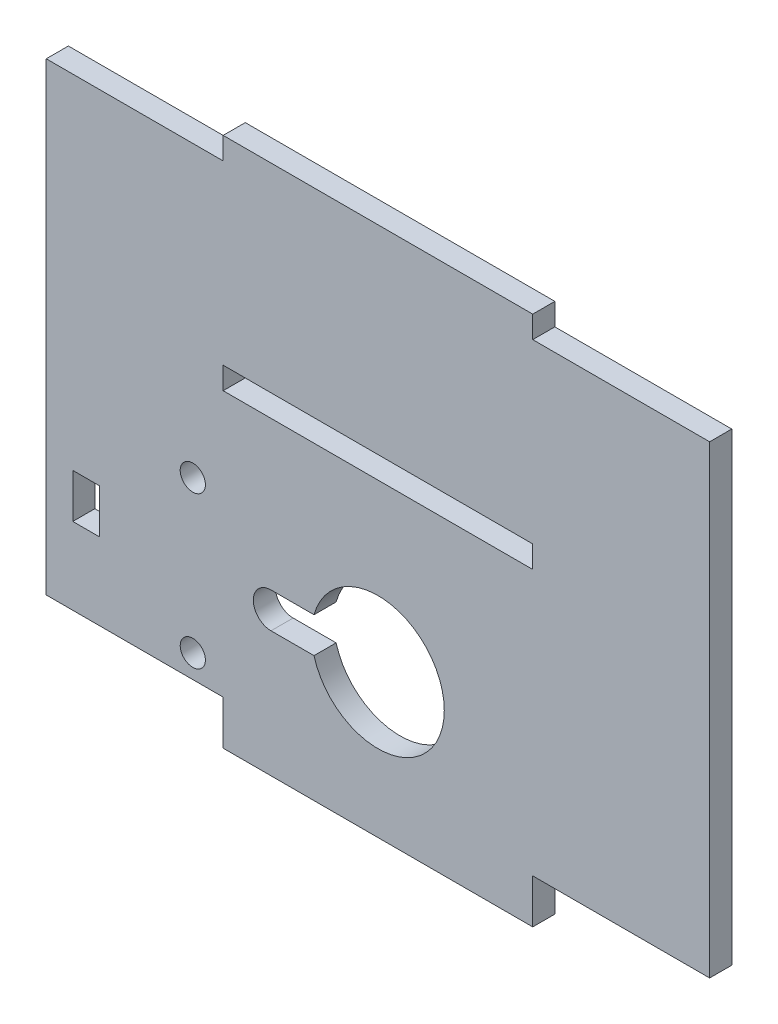
from build123d import *

# Parameters (mm, degrees)
SKETCH1_R           = 1.425
SKETCH1_W           = 3
SKETCH1_H           = 5
SKETCH1_W_2         = 35
SKETCH1_H_2         = 2.5
BOSS_EXTRUDE1_DEPTH = 2.5


with BuildPart() as part:
    # Sketch1 → Boss-Extrude1 (new body)
    with BuildSketch(Plane.XY):
        Polygon((17.5, 30), (-17.5, 30), (-17.5, 27.5), (-37.5, 27.5), (-37.5, -25), (-17.5, -25), (-17.5, -30), (17.5, -30), (17.5, -25), (37.5, -25), (37.5, 27.5), (17.5, 27.5), align=None)
        with Locations((-20.93, -5.22)):
            Circle(SKETCH1_R, mode=Mode.SUBTRACT)
        with Locations(Location((-20.93, -22.38, 0), (0, 0, 180))):
            Circle(SKETCH1_R, mode=Mode.SUBTRACT)
        with BuildLine():
            Line((-12.09, -11.8), (-7.228416147, -11.8))
            ThreePointArc((-7.228416147, -11.8), (7.5, -13.8), (-7.228416147, -15.8))
            Line((-7.228416147, -15.8), (-12.09, -15.8))
            ThreePointArc((-12.09, -15.8), (-14.09, -13.8), (-12.09, -11.8))
        make_face(mode=Mode.SUBTRACT)
        with Locations((-33, -13.8)):
            Rectangle(SKETCH1_W, SKETCH1_H, mode=Mode.SUBTRACT)
        with Locations((0, 6.25)):
            Rectangle(SKETCH1_W_2, SKETCH1_H_2, mode=Mode.SUBTRACT)
    extrude(amount=BOSS_EXTRUDE1_DEPTH)


solid = part.part
